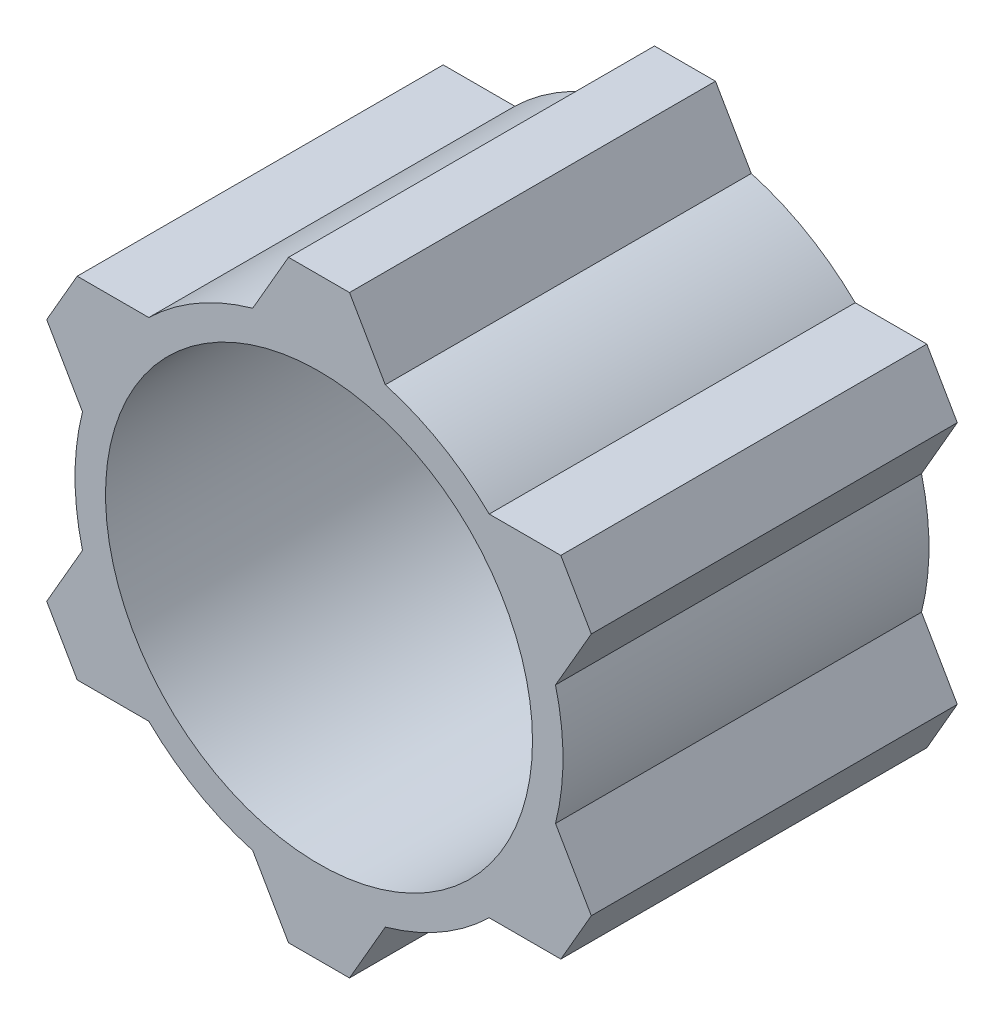
from build123d import *
from build123d.topology import SkipClean

# Parameters (mm, degrees)
SKETCH1_R           = 5
BOSS_EXTRUDE1_DEPTH = 10
BOSS_EXTRUDE2_DEPTH = 50


with BuildPart() as part:
    # Sketch1 → Boss-Extrude1 (new body)
    with BuildSketch(Plane.XY):
        with BuildLine():
            Line((-5, 48.660254038), (-10, 40))
            Line((-10, 40), (-10.868896713, 38.495026747))
            ThreePointArc((-10.868896713, 38.495026747), (-20, 34.641016151), (-27.903222726, 28.660254038))
            Line((-27.903222726, 28.660254038), (-29.641016151, 28.660254038))
            Line((-29.641016151, 28.660254038), (-39.641016151, 28.660254038))
            Line((-39.641016151, 28.660254038), (-44.641016151, 20))
            Line((-44.641016151, 20), (-39.641016151, 11.339745962))
            Line((-39.641016151, 11.339745962), (-38.772119439, 9.834772709))
            ThreePointArc((-38.772119439, 9.834772709), (-40, 0), (-38.772119439, -9.834772709))
            Line((-38.772119439, -9.834772709), (-39.641016151, -11.339745962))
            Line((-39.641016151, -11.339745962), (-44.641016151, -20))
            Line((-44.641016151, -20), (-39.641016151, -28.660254038))
            Line((-39.641016151, -28.660254038), (-29.641016151, -28.660254038))
            Line((-29.641016151, -28.660254038), (-27.903222726, -28.660254038))
            ThreePointArc((-27.903222726, -28.660254038), (-20, -34.641016151), (-10.868896713, -38.495026747))
            Line((-10.868896713, -38.495026747), (-10, -40))
            Line((-10, -40), (-5, -48.660254038))
            Line((-5, -48.660254038), (5, -48.660254038))
            Line((5, -48.660254038), (10, -40))
            Line((10, -40), (10.868896713, -38.495026747))
            ThreePointArc((10.868896713, -38.495026747), (20, -34.641016151), (27.903222726, -28.660254038))
            Line((27.903222726, -28.660254038), (29.641016151, -28.660254038))
            Line((29.641016151, -28.660254038), (39.641016151, -28.660254038))
            Line((39.641016151, -28.660254038), (44.641016151, -20))
            Line((44.641016151, -20), (39.641016151, -11.339745962))
            Line((39.641016151, -11.339745962), (38.772119439, -9.834772709))
            ThreePointArc((38.772119439, -9.834772709), (40, 0), (38.772119439, 9.834772709))
            Line((38.772119439, 9.834772709), (39.641016151, 11.339745962))
            Line((39.641016151, 11.339745962), (44.641016151, 20))
            Line((44.641016151, 20), (39.641016151, 28.660254038))
            Line((39.641016151, 28.660254038), (29.641016151, 28.660254038))
            Line((29.641016151, 28.660254038), (27.903222726, 28.660254038))
            ThreePointArc((27.903222726, 28.660254038), (20, 34.641016151), (10.868896713, 38.495026747))
            Line((10.868896713, 38.495026747), (10, 40))
            Line((10, 40), (5, 48.660254038))
            Line((5, 48.660254038), (-5, 48.660254038))
        make_face()
        Circle(SKETCH1_R, mode=Mode.SUBTRACT)
        with BuildLine():
            Line((-2.5, 9.682458366), (-2.5, 34.910600109))
            ThreePointArc((-2.5, 34.910600109), (-17.5, 30.310889132), (-28.983466556, 19.620363564))
            Line((-28.983466556, 19.620363564), (-7.135254916, 7.006292692))
            ThreePointArc((-7.135254916, 7.006292692), (-5, 8.660254038), (-2.5, 9.682458366))
        make_face(mode=Mode.SUBTRACT)
        with BuildLine():
            Line((2.5, 34.910600109), (2.5, 9.682458366))
            ThreePointArc((2.5, 9.682458366), (5, 8.660254038), (7.135254916, 7.006292692))
            Line((7.135254916, 7.006292692), (28.983466556, 19.620363564))
            ThreePointArc((28.983466556, 19.620363564), (17.5, 30.310889132), (2.5, 34.910600109))
        make_face(mode=Mode.SUBTRACT)
        with BuildLine():
            Line((31.483466556, 15.290236545), (9.635254916, 2.676165673))
            ThreePointArc((9.635254916, 2.676165673), (10, 0), (9.635254916, -2.676165673))
            Line((9.635254916, -2.676165673), (31.483466556, -15.290236545))
            ThreePointArc((31.483466556, -15.290236545), (35, 0), (31.483466556, 15.290236545))
        make_face(mode=Mode.SUBTRACT)
        with BuildLine():
            Line((28.983466556, -19.620363564), (7.135254916, -7.006292692))
            ThreePointArc((7.135254916, -7.006292692), (5, -8.660254038), (2.5, -9.682458366))
            Line((2.5, -9.682458366), (2.5, -34.910600109))
            ThreePointArc((2.5, -34.910600109), (17.5, -30.310889132), (28.983466556, -19.620363564))
        make_face(mode=Mode.SUBTRACT)
        with BuildLine():
            Line((-2.5, -34.910600109), (-2.5, -9.682458366))
            ThreePointArc((-2.5, -9.682458366), (-5, -8.660254038), (-7.135254916, -7.006292692))
            Line((-7.135254916, -7.006292692), (-28.983466556, -19.620363564))
            ThreePointArc((-28.983466556, -19.620363564), (-17.5, -30.310889132), (-2.5, -34.910600109))
        make_face(mode=Mode.SUBTRACT)
        with BuildLine():
            Line((-31.483466556, -15.290236545), (-9.635254916, -2.676165673))
            ThreePointArc((-9.635254916, -2.676165673), (-10, 0), (-9.635254916, 2.676165673))
            Line((-9.635254916, 2.676165673), (-31.483466556, 15.290236545))
            ThreePointArc((-31.483466556, 15.290236545), (-35, 0), (-31.483466556, -15.290236545))
        make_face(mode=Mode.SUBTRACT)
    extrude(amount=BOSS_EXTRUDE1_DEPTH)

    # Sketch2 → Boss-Extrude2 (add)
    with SkipClean():  # the faces are left unmerged after this step: merging them gives an invalid solid
        with BuildSketch(Plane.XY.offset(10)):
            with BuildLine():
                Line((-44.641016151, 20), (-38.772119439, 9.834772709))
                ThreePointArc((-38.772119439, 9.834772709), (-40, 0), (-38.772119439, -9.834772709))
                Line((-38.772119439, -9.834772709), (-44.641016151, -20))
                Line((-44.641016151, -20), (-39.641016151, -28.660254038))
                Line((-39.641016151, -28.660254038), (-27.903222726, -28.660254038))
                ThreePointArc((-27.903222726, -28.660254038), (-20, -34.641016151), (-10.868896713, -38.495026747))
                Line((-10.868896713, -38.495026747), (-5, -48.660254038))
                Line((-5, -48.660254038), (5, -48.660254038))
                Line((5, -48.660254038), (10.868896713, -38.495026747))
                ThreePointArc((10.868896713, -38.495026747), (20, -34.641016151), (27.903222726, -28.660254038))
                Line((27.903222726, -28.660254038), (39.641016151, -28.660254038))
                Line((39.641016151, -28.660254038), (44.641016151, -20))
                Line((44.641016151, -20), (38.772119439, -9.834772709))
                ThreePointArc((38.772119439, -9.834772709), (40, 0), (38.772119439, 9.834772709))
                Line((38.772119439, 9.834772709), (44.641016151, 20))
                Line((44.641016151, 20), (39.641016151, 28.660254038))
                Line((39.641016151, 28.660254038), (27.903222726, 28.660254038))
                ThreePointArc((27.903222726, 28.660254038), (20, 34.641016151), (10.868896713, 38.495026747))
                Line((10.868896713, 38.495026747), (5, 48.660254038))
                Line((5, 48.660254038), (-5, 48.660254038))
                Line((-5, 48.660254038), (-10.868896713, 38.495026747))
                ThreePointArc((-10.868896713, 38.495026747), (-20, 34.641016151), (-27.903222726, 28.660254038))
                Line((-27.903222726, 28.660254038), (-39.641016151, 28.660254038))
                Line((-39.641016151, 28.660254038), (-44.641016151, 20))
            make_face()
            with BuildLine():
                ThreePointArc((31.483466556, 15.290236545), (34.109539204, 7.844701095), (35, 0))
                ThreePointArc((35, 0), (34.109539204, -7.844701095), (31.483466556, -15.290236545))
                ThreePointArc((31.483466556, -15.290236545), (30.310889132, -17.5), (28.983466556, -19.620363564))
                ThreePointArc((28.983466556, -19.620363564), (17.5, -30.310889132), (2.5, -34.910600109))
                ThreePointArc((2.5, -34.910600109), (0, -35), (-2.5, -34.910600109))
                ThreePointArc((-2.5, -34.910600109), (-17.5, -30.310889132), (-28.983466556, -19.620363564))
                ThreePointArc((-28.983466556, -19.620363564), (-30.310889132, -17.5), (-31.483466556, -15.290236545))
                ThreePointArc((-31.483466556, -15.290236545), (-35, 0), (-31.483466556, 15.290236545))
                ThreePointArc((-31.483466556, 15.290236545), (-30.310889132, 17.5), (-28.983466556, 19.620363564))
                ThreePointArc((-28.983466556, 19.620363564), (-17.5, 30.310889132), (-2.5, 34.910600109))
                ThreePointArc((-2.5, 34.910600109), (0, 35), (2.5, 34.910600109))
                ThreePointArc((2.5, 34.910600109), (17.5, 30.310889132), (28.983466556, 19.620363564))
                ThreePointArc((28.983466556, 19.620363564), (30.310889132, 17.5), (31.483466556, 15.290236545))
            make_face(mode=Mode.SUBTRACT)
        extrude(amount=BOSS_EXTRUDE2_DEPTH)


solid = part.part
